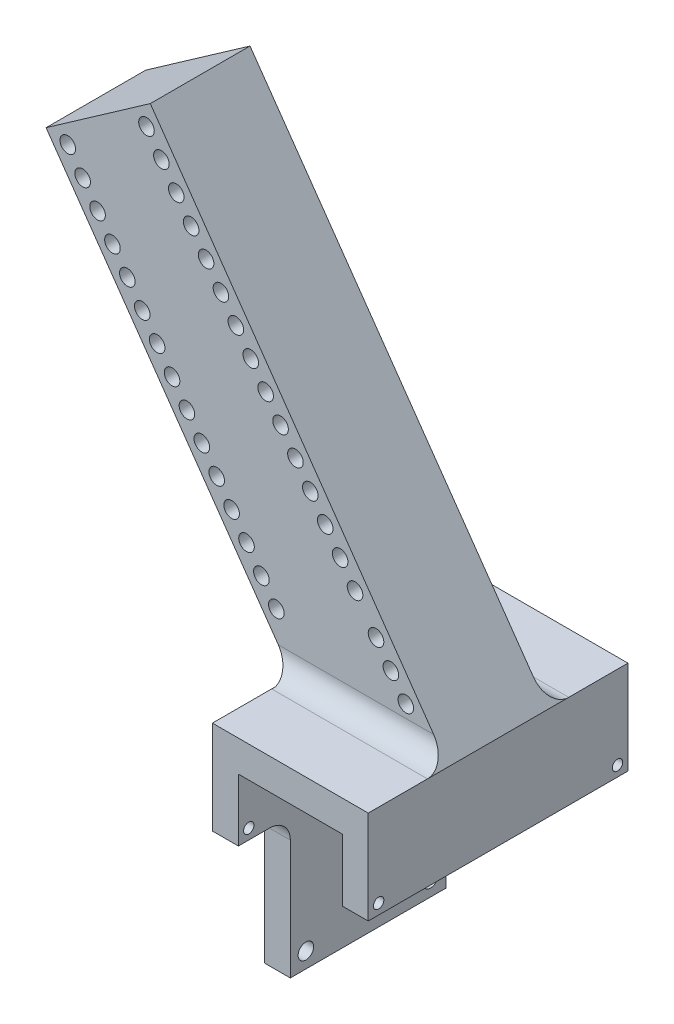
from build123d import *

# Parameters (mm, degrees)
BOSS_EXTRUDE1_DEPTH     = 50
SKETCH2_W               = 30
SKETCH2_H               = 27
SKETCH2_R               = 1.5
BOSS_EXTRUDE2_DEPTH     = 5
CUT_EXTRUDE1_DEPTH      = 65.257295306
CUT_EXTRUDE1_DEPTH_BACK = 65.257295306
SKETCH3_R               = 1
SKETCH5_W               = 19.2
SKETCH5_H               = 100
BOSS_EXTRUDE5_DEPTH     = 24.5
SKETCH5_2_W             = 19.2
SKETCH5_2_H             = 100
CUT_EXTRUDE3_DEPTH      = 80
SKETCH4_W               = 20
SKETCH4_H               = 21.42095117
CUT_EXTRUDE4_DEPTH      = 80
SKETCH9_R               = 1.5
CUT_EXTRUDE6_DEPTH      = 19.2
FILLET3_R               = 4
FILLET6_R               = 4


with BuildPart() as part:
    # Sketch1 → Boss-Extrude1 (new body)
    with BuildSketch(Plane.XY):
        Polygon((0, 0), (0, 18), (30, 18), (30, 0), (25, 0), (25, 12), (5, 12), (5, 0), align=None)
    extrude(amount=BOSS_EXTRUDE1_DEPTH)

    # Sketch2 → Boss-Extrude2 (add)
    with BuildSketch(Plane.ZY):
        with Locations((25, -13.5)):
            Rectangle(SKETCH2_W, SKETCH2_H)
        with Locations((13, -24)):
            Circle(SKETCH2_R, mode=Mode.SUBTRACT)
        with Locations(Location((37, -24, 0), (0, 0, 180))):
            Circle(SKETCH2_R, mode=Mode.SUBTRACT)
    extrude(amount=-BOSS_EXTRUDE2_DEPTH)

    # Sketch3 → Cut-Extrude1 (cut, two sides: drawn at the far end of the back side and taken through both)
    with BuildSketch(Plane(origin=(30, 0, 0), x_dir=(0, 0, -1), z_dir=(1, 0, 0)).offset(-CUT_EXTRUDE1_DEPTH_BACK)):
        with Locations(Location((-48, 2, 0), (0, 0, 90))):
            Circle(SKETCH3_R)
        with Locations(Location((-2, 2, 0), (0, 0, 180))):
            Circle(SKETCH3_R)
    extrude(amount=CUT_EXTRUDE1_DEPTH + CUT_EXTRUDE1_DEPTH_BACK, mode=Mode.SUBTRACT)

    # Sketch5 → Boss-Extrude5 (add, symmetric)
    with BuildSketch(Plane(origin=(28.587535737, 20.017208022, 0), x_dir=(0, 0, -1), z_dir=(0.8191520442889919, 0.573576436351046, 0))):
        with Locations((-25, 47.537443707)):
            Rectangle(SKETCH5_W, SKETCH5_H)
    extrude(amount=BOSS_EXTRUDE5_DEPTH, both=True)

    # Sketch5<2> → Cut-Extrude3 (cut)
    with BuildSketch(Plane(origin=(28.587535737, 20.017208022, 0), x_dir=(0, 0, -1), z_dir=(0.8191520442889919, 0.573576436351046, 0))):
        with Locations((-25, 47.537443707)):
            Rectangle(SKETCH5_2_W, SKETCH5_2_H)
    extrude(amount=CUT_EXTRUDE3_DEPTH, mode=Mode.SUBTRACT)

    # Sketch4 → Cut-Extrude4 (cut)
    with BuildSketch(Plane(origin=(0, 12, 0), x_dir=(1, 0, 0), z_dir=(0, 1, 0))):
        with Locations((15, -24.710475585)):
            Rectangle(SKETCH4_W, SKETCH4_H)
    extrude(amount=-CUT_EXTRUDE4_DEPTH, mode=Mode.SUBTRACT)

    # Sketch9 → Cut-Extrude6 (cut)
    with BuildSketch(Plane.XY.offset(34.6)):
        with Locations((-43.248683278, 85.125854914)):
            Circle(SKETCH9_R)
        with Locations((-40.380801097, 81.030094693)):
            Circle(SKETCH9_R)
        with Locations((-37.512918915, 76.934334472)):
            Circle(SKETCH9_R)
        with Locations((-34.645036733, 72.83857425)):
            Circle(SKETCH9_R)
        with Locations((-31.777154551, 68.742814029)):
            Circle(SKETCH9_R)
        with Locations((-28.909272369, 64.647053807)):
            Circle(SKETCH9_R)
        with Locations((-26.041390188, 60.551293586)):
            Circle(SKETCH9_R)
        with Locations((-23.173508006, 56.455533364)):
            Circle(SKETCH9_R)
        with Locations((-20.305625824, 52.359773143)):
            Circle(SKETCH9_R)
        with Locations((-17.437743642, 48.264012921)):
            Circle(SKETCH9_R)
        with Locations((-14.569861461, 44.1682527)):
            Circle(SKETCH9_R)
        with Locations((-11.701979279, 40.072492479)):
            Circle(SKETCH9_R)
        with Locations((-8.834097097, 35.976732257)):
            Circle(SKETCH9_R)
        with Locations((-5.966214915, 31.880972036)):
            Circle(SKETCH9_R)
        with Locations((-3.098332734, 27.785211814)):
            Circle(SKETCH9_R)
        with Locations((21.833754852, 24.432266344)):
            Circle(SKETCH9_R)
        with Locations((18.96587267, 28.528026566)):
            Circle(SKETCH9_R)
        with Locations((16.097990488, 32.623786787)):
            Circle(SKETCH9_R)
        with Locations((12.055980086, 38.396375887)):
            Circle(SKETCH9_R)
        with Locations((9.188097904, 42.492136108)):
            Circle(SKETCH9_R)
        with Locations((6.320215722, 46.58789633)):
            Circle(SKETCH9_R)
        with Locations((3.45233354, 50.683656551)):
            Circle(SKETCH9_R)
        with Locations((0.584451359, 54.779416773)):
            Circle(SKETCH9_R)
        with Locations((-2.283430823, 58.875176994)):
            Circle(SKETCH9_R)
        with Locations((-5.151313005, 62.970937215)):
            Circle(SKETCH9_R)
        with Locations((-8.019195187, 67.066697437)):
            Circle(SKETCH9_R)
        with Locations((-10.887077368, 71.162457658)):
            Circle(SKETCH9_R)
        with Locations((-13.75495955, 75.25821788)):
            Circle(SKETCH9_R)
        with Locations((-16.622841732, 79.353978101)):
            Circle(SKETCH9_R)
        with Locations((-19.490723914, 83.449738323)):
            Circle(SKETCH9_R)
        with Locations((-22.358606095, 87.545498544)):
            Circle(SKETCH9_R)
        with Locations((-25.226488277, 91.641258766)):
            Circle(SKETCH9_R)
        with Locations((-28.094370459, 95.737018987)):
            Circle(SKETCH9_R)
    extrude(amount=-CUT_EXTRUDE6_DEPTH, mode=Mode.SUBTRACT)

    # Fillet3
    fillet3_edges = [part.edges().sort_by_distance(p)[0] for p in [
        (15.045511288, 18, 34.6),
        (15.045511288, 18, 15.4),
    ]]
    fillet(fillet3_edges, radius=FILLET3_R)

    # Fillet6
    fillet6_edges = [part.edges().sort_by_distance(p)[0] for p in [
        (2.5, 0, 10),
        (2.5, 0, 40),
    ]]
    fillet(fillet6_edges, radius=FILLET6_R)


solid = part.part
